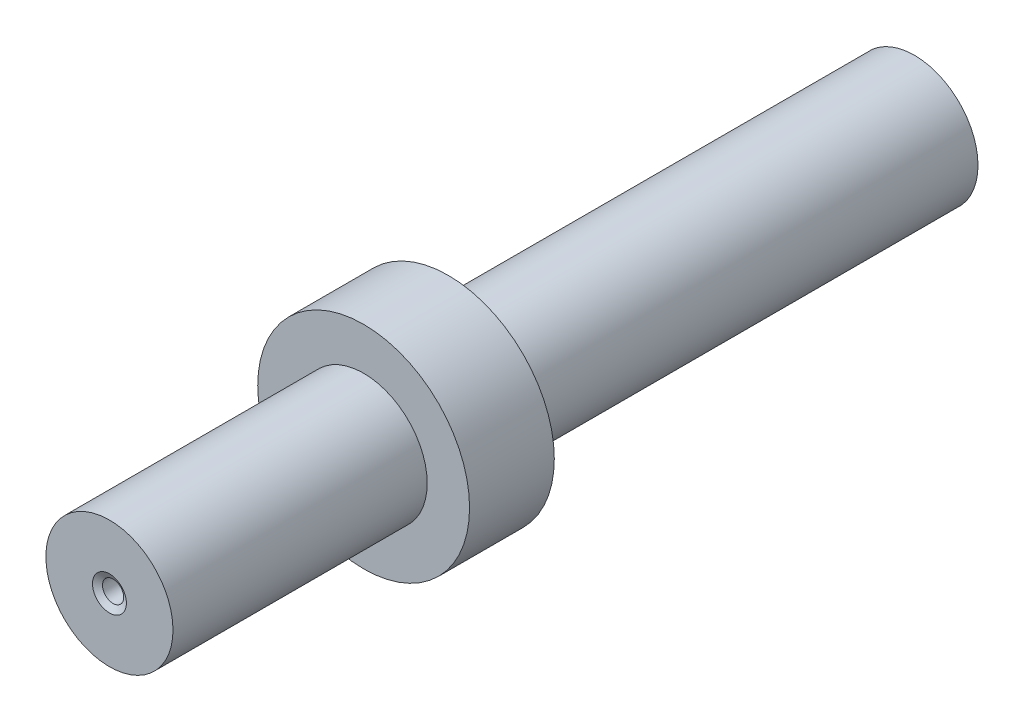
from build123d import *

# Parameters (mm, degrees)
SKETCH1_R                       = 12.5
F_25MM_DIA_DEPTH                = 10
F_15MM_START                    = -10
SKETCH2_R                       = 7.5
F_15MM_DIA_BEARING_END_DEPTH    = 40
F_15MM_START_2                  = 55
SKETCH3_R                       = 7.5
F_15MM_DIA_GEAR_END_DEPTH       = 55
M3X0_5_TAPPED_HOLE1_D           = 2.5
M3X0_5_TAPPED_HOLE1_DEPTH       = 15
M3X0_5_TAPPED_HOLE1_CSINK_D     = 4
M3X0_5_TAPPED_HOLE1_CSINK_ANGLE = 120
M3X0_5_TAPPED_HOLE1_TIP         = 0.751075774


with BuildPart() as part:
    # Sketch1 → 25mm dia (new body)
    with BuildSketch(Plane.XY):
        Circle(SKETCH1_R)
    extrude(amount=F_25MM_DIA_DEPTH)

    # Sketch2 → 15mm dia bearing end (add)
    with BuildSketch(Plane.XY.offset(10).offset(F_15MM_START)):
        Circle(SKETCH2_R)
    extrude(amount=F_15MM_DIA_BEARING_END_DEPTH)

    # Sketch3 → 15mm dia gear end (add)
    with BuildSketch(Plane(origin=(0, 0, 0), x_dir=(-1, 0, 0), z_dir=(0, 0, -1)).offset(F_15MM_START_2)):
        with Locations(Location((0, 0, 0), (0, 0, 180))):
            Circle(SKETCH3_R)
    extrude(amount=-F_15MM_DIA_GEAR_END_DEPTH)

    # M3x0.5 Tapped Hole1
    with Locations(Plane.XY.offset(40)):
        with Locations((0, 0)):
            CounterSinkHole(M3X0_5_TAPPED_HOLE1_D / 2, M3X0_5_TAPPED_HOLE1_CSINK_D / 2, depth=M3X0_5_TAPPED_HOLE1_DEPTH, counter_sink_angle=M3X0_5_TAPPED_HOLE1_CSINK_ANGLE)
            with Locations((0, 0, -(M3X0_5_TAPPED_HOLE1_DEPTH + M3X0_5_TAPPED_HOLE1_TIP / 2))):  # 118° drill point
                Cone(0, M3X0_5_TAPPED_HOLE1_D / 2, M3X0_5_TAPPED_HOLE1_TIP, mode=Mode.SUBTRACT)


solid = part.part
